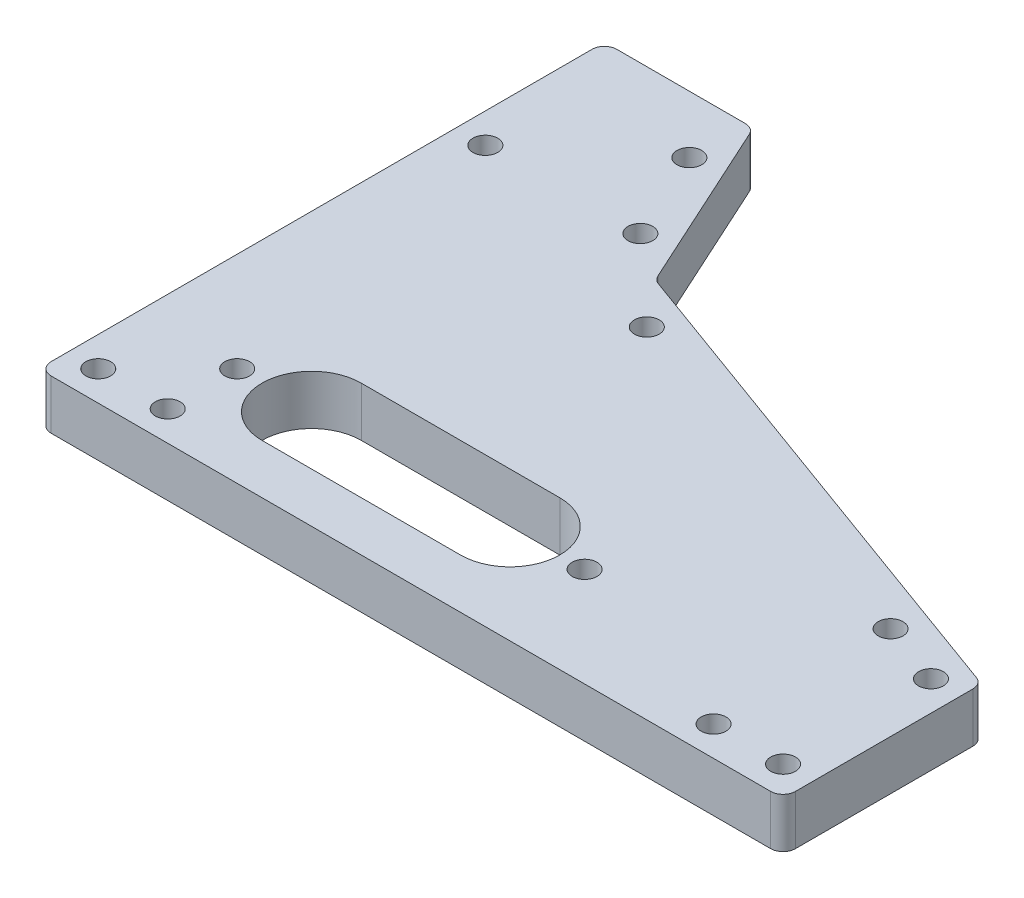
from build123d import *

# Parameters (mm, degrees)
BASE_R              = 3.175
BOSS_EXTRUDE1_DEPTH = 12.7
ROUTER_FILLET_R     = 3.175


with BuildPart() as part:
    # base → Boss-Extrude1 (new body)
    with BuildSketch(Plane(origin=(0, 0, 0), x_dir=(1, 0, 0), z_dir=(0, 1, 0))):
        Polygon((0, 144.779530825), (38.1, 144.779530825), (59.224940876, 98.580214023), (190.5, 50.8), (190.5, 0), (0, 0), align=None)
        with Locations(Location((166.631807432, 51.378277014, 0), (0, 0, 270))):
            Circle(BASE_R, mode=Mode.SUBTRACT)
        with Locations(Location((36.451337699, 130.060960493, 0), (0, 0, 270))):
            Circle(BASE_R, mode=Mode.SUBTRACT)
        with Locations(Location((182.88, 45.464418559, 0), (0, 0, 270))):
            Circle(BASE_R, mode=Mode.SUBTRACT)
        with Locations(Location((68.552843668, 87.076100432, 0), (0, 0, 270))):
            Circle(BASE_R, mode=Mode.SUBTRACT)
        with Locations(Location((47.013808137, 106.961302092, 0), (0, 0, 270))):
            Circle(BASE_R, mode=Mode.SUBTRACT)
        with Locations(Location((182.88, 7.62, 0), (0, 0, 270))):
            Circle(BASE_R, mode=Mode.SUBTRACT)
        with Locations(Location((7.62, 7.62, 0), (0, 0, 270))):
            Circle(BASE_R, mode=Mode.SUBTRACT)
        with Locations(Location((7.62, 106.679530825, 0), (0, 0, 270))):
            Circle(BASE_R, mode=Mode.SUBTRACT)
        with Locations(Location((25.4, 7.62, 0), (0, 0, 270))):
            Circle(BASE_R, mode=Mode.SUBTRACT)
        with Locations(Location((165.1, 7.62, 0), (0, 0, 270))):
            Circle(BASE_R, mode=Mode.SUBTRACT)
        with Locations(Location((25.4, 25.4, 0), (0, 0, 270))):
            Circle(BASE_R, mode=Mode.SUBTRACT)
        with Locations(Location((114.3, 25.4, 0), (0, 0, 270))):
            Circle(BASE_R, mode=Mode.SUBTRACT)
        with BuildLine():
            Line((95.25, 12.7), (44.45, 12.7))
            ThreePointArc((44.45, 12.7), (31.75, 25.4), (44.45, 38.1))
            Line((44.45, 38.1), (95.25, 38.1))
            ThreePointArc((95.25, 38.1), (107.95, 25.4), (95.25, 12.7))
        make_face(mode=Mode.SUBTRACT)
    extrude(amount=BOSS_EXTRUDE1_DEPTH)

    # router_fillet
    router_fillet_edges = [part.edges().sort_by_distance(p)[0] for p in [
        (0, 6.35, -144.779530825),
        (38.1, 6.35, -144.779530825),
        (59.224940876, 6.35, -98.580214023),
        (190.5, 6.35, -50.8),
        (190.5, 6.35, 0),
        (0, 6.35, 0),
    ]]
    fillet(router_fillet_edges, radius=ROUTER_FILLET_R)


solid = part.part
